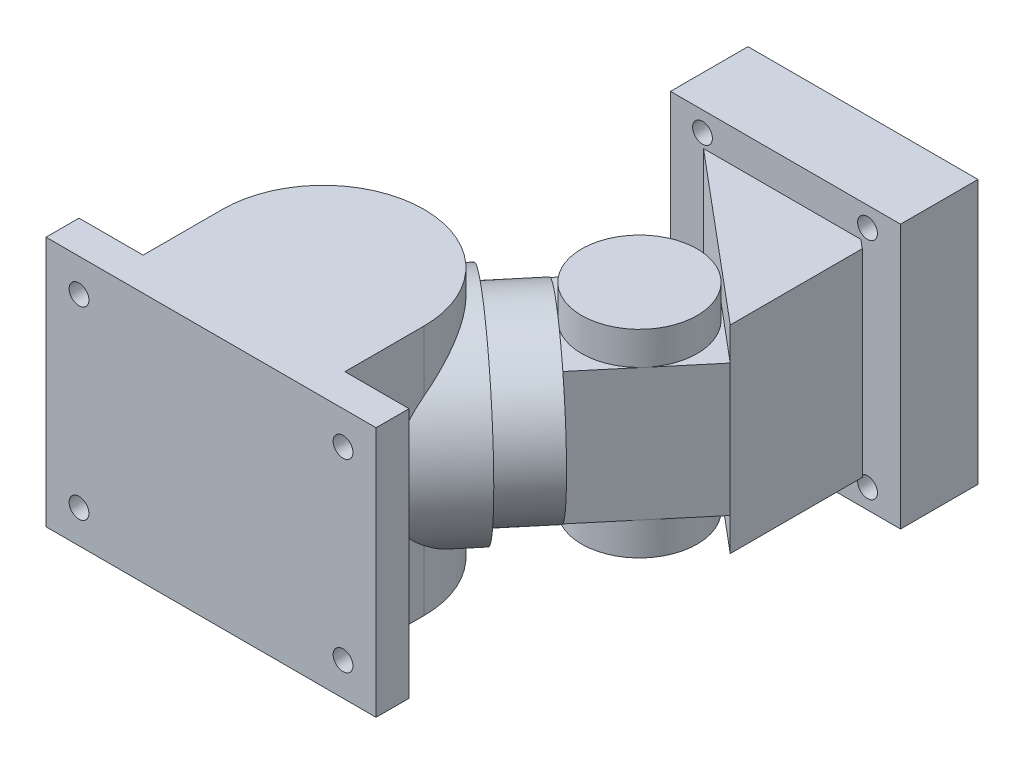
from build123d import *
from build123d.topology import SkipClean

# Parameters (mm, degrees)
SALIENTE_EXTRUIR1_DEPTH       = 15
SALIENTE_EXTRUIR1_DEPTH_BACK  = 15
SALIENTE_EXTRUIR3_DEPTH       = 10
SALIENTE_EXTRUIR3_DEPTH_BACK  = 10
SALIENTE_EXTRUIR9_DEPTH       = 5
SALIENTE_EXTRUIR9_DEPTH_BACK  = 25
CROQUIS4_R                    = 8.75
SALIENTE_EXTRUIR10_DEPTH      = 10
SALIENTE_EXTRUIR10_DEPTH_BACK = 10
CROQUIS6_R                    = 13.287682266
SALIENTE_EXTRUIR11_DEPTH      = 8
CROQUIS7_R                    = 15.287682266
SALIENTE_EXTRUIR12_DEPTH      = 17
SALIENTE_EXTRUIR13_DEPTH      = 17
SALIENTE_EXTRUIR13_DEPTH_BACK = 17
CROQUIS9_R                    = 15.287682266
SALIENTE_EXTRUIR14_DEPTH      = 2
SALIENTE_EXTRUIR14_DEPTH_BACK = 36
SALIENTE_EXTRUIR15_DEPTH      = 5
SALIENTE_EXTRUIR15_DEPTH_BACK = 35
CROQUIS11_W                   = 34.848077531
CROQUIS11_H                   = 11.736481777
CROQUIS12_R                   = 1.5
CORTAR_EXTRUIR1_DEPTH         = 35000
CROQUIS13_R                   = 1.5
CORTAR_EXTRUIR2_DEPTH         = 35000


with BuildPart() as part:
    # Croquis1 → Saliente-Extruir1 (new, two sides: drawn at the far end of the back side and taken through both)
    with BuildSketch(Plane(origin=(0, 0, 0), x_dir=(1, 0, 0), z_dir=(0, 1, 0)).offset(-SALIENTE_EXTRUIR1_DEPTH_BACK)):
        Polygon((0, 0), (0, 20), (-15.320888862, 32.855752194), (-25.168966393, 21.119270417), align=None)
    extrude(amount=SALIENTE_EXTRUIR1_DEPTH + SALIENTE_EXTRUIR1_DEPTH_BACK)

    # Croquis2 → Saliente-Extruir3 (add, two sides: drawn at the far end of the back side and taken through both)
    with BuildSketch(Plane(origin=(0, 0, 0), x_dir=(1, 0, 0), z_dir=(0, 1, 0)).offset(-SALIENTE_EXTRUIR3_DEPTH_BACK)):
        with BuildLine():
            Line((0, 0), (-13.405777755, 11.24878317))
            Line((-13.405777755, 11.24878317), (-19.190866242, 4.354383181))
            ThreePointArc((-19.190866242, 4.354383181), (-18.112368949, -7.972897281), (-5.785088487, -6.894399988))
            Line((-5.785088487, -6.894399988), (0, 0))
        make_face()
    extrude(amount=SALIENTE_EXTRUIR3_DEPTH + SALIENTE_EXTRUIR3_DEPTH_BACK)

    # Croquis4 → Saliente-Extruir9 (add, two sides: drawn at the far end of the back side and taken through both)
    with SkipClean():  # the faces are left unmerged after this step: merging them gives an invalid solid
        with BuildSketch(Plane(origin=(0, 10, 0), x_dir=(1, 0, 0), z_dir=(0, 1, 0)).offset(-SALIENTE_EXTRUIR9_DEPTH_BACK)):
            with Locations((-12.487977364, -1.270008403)):
                Circle(CROQUIS4_R)
        extrude(amount=SALIENTE_EXTRUIR9_DEPTH + SALIENTE_EXTRUIR9_DEPTH_BACK)

    # Croquis5 → Saliente-Extruir10 (add, two sides: drawn at the far end of the back side and taken through both)
    with BuildSketch(Plane(origin=(0, 0, 0), x_dir=(1, 0, 0), z_dir=(0, 1, 0)).offset(-SALIENTE_EXTRUIR10_DEPTH_BACK)):
        with BuildLine():
            Line((-11.570176974, -13.788799976), (-5.785088487, -6.894399988))
            ThreePointArc((-5.785088487, -6.894399988), (-6.86358578, 5.432880474), (-19.190866242, 4.354383181))
            Line((-19.190866242, 4.354383181), (-24.975954729, -2.540016807))
            Line((-24.975954729, -2.540016807), (-11.570176974, -13.788799976))
        make_face()
    extrude(amount=SALIENTE_EXTRUIR10_DEPTH + SALIENTE_EXTRUIR10_DEPTH_BACK)

    # Croquis6 → Saliente-Extruir11 (add)
    with BuildSketch(Plane(origin=(-11.570176974, 0, 13.788799976), x_dir=(0.7660444431189747, 0, 0.6427876096865435), z_dir=(-0.6427876096865434, 0, 0.7660444431189746))):
        with Locations((-8.75, 0)):
            Circle(CROQUIS6_R)
    extrude(amount=SALIENTE_EXTRUIR11_DEPTH)

    # Croquis7 → Saliente-Extruir12 (add)
    with BuildSketch(Plane(origin=(-16.712477852, 0, 19.917155521), x_dir=(0.7660444431189747, 0, 0.6427876096865435), z_dir=(-0.6427876096865434, 0, 0.7660444431189746))):
        with Locations((-8.75, 0)):
            Circle(CROQUIS7_R)
    extrude(amount=SALIENTE_EXTRUIR12_DEPTH)

    # Croquis9 → Saliente-Extruir13 (add, two sides: drawn at the far end of the back side and taken through both)
    with BuildSketch(Plane(origin=(0, 0, 0), x_dir=(1, 0, 0), z_dir=(0, 1, 0)).offset(-SALIENTE_EXTRUIR13_DEPTH_BACK)):
        with Locations((-34.342756094, -27.315519469)):
            Circle(CROQUIS9_R)
    extrude(amount=SALIENTE_EXTRUIR13_DEPTH + SALIENTE_EXTRUIR13_DEPTH_BACK)

    # Croquis10 → Saliente-Extruir14 (add, two sides: drawn at the far end of the back side and taken through both)
    with BuildSketch(Plane(origin=(0, 17, 0), x_dir=(1, 0, 0), z_dir=(0, 1, 0)).offset(-SALIENTE_EXTRUIR14_DEPTH_BACK)):
        with BuildLine():
            Line((-49.63043836, -27.315519469), (-49.63043836, -39.315519469))
            Line((-49.63043836, -39.315519469), (-59.342756094, -39.315519469))
            Line((-59.342756094, -39.315519469), (-59.342756094, -44.315519469))
            Line((-59.342756094, -44.315519469), (-9.342756094, -44.315519469))
            Line((-9.342756094, -44.315519469), (-9.342756094, -39.315519469))
            Line((-9.342756094, -39.315519469), (-19.055073828, -39.315519469))
            Line((-19.055073828, -39.315519469), (-19.055073828, -27.315519469))
            ThreePointArc((-19.055073828, -27.315519469), (-34.342756094, -12.027837203), (-49.63043836, -27.315519469))
        make_face()
    extrude(amount=SALIENTE_EXTRUIR14_DEPTH + SALIENTE_EXTRUIR14_DEPTH_BACK)

    # Croquis11 → Saliente-Extruir15 (add, two sides: drawn at the far end of the back side and taken through both)
    with BuildSketch(Plane(origin=(0, 15, 0), x_dir=(1, 0, 0), z_dir=(0, 1, 0)).offset(-SALIENTE_EXTRUIR15_DEPTH_BACK)):
        with Locations((-12.744927628, 26.987511306)):
            Rectangle(CROQUIS11_W, CROQUIS11_H)
    extrude(amount=SALIENTE_EXTRUIR15_DEPTH + SALIENTE_EXTRUIR15_DEPTH_BACK)

    # Croquis12 → Cortar-Extruir1 (cut)
    with BuildSketch(Plane.XY.offset(-21.119270417)):
        with Locations((-0.320888862, 17)):
            Circle(CROQUIS12_R)
        with Locations((-25.320888862, 17)):
            Circle(CROQUIS12_R)
        with Locations((-25.320888862, -17)):
            Circle(CROQUIS12_R)
        with Locations((-0.320888862, -17)):
            Circle(CROQUIS12_R)
    extrude(amount=-CORTAR_EXTRUIR1_DEPTH, mode=Mode.SUBTRACT)

    # Croquis13 → Cortar-Extruir2 (cut)
    with BuildSketch(Plane(origin=(0, 0, 39.315519469), x_dir=(-1, 0, 0), z_dir=(0, 0, -1))):
        with Locations((54.342756094, 14)):
            Circle(CROQUIS13_R)
        with Locations((54.342756094, -14)):
            Circle(CROQUIS13_R)
        with Locations((14.342756094, 14)):
            Circle(CROQUIS13_R)
        with Locations((14.342756094, -14)):
            Circle(CROQUIS13_R)
    extrude(amount=-CORTAR_EXTRUIR2_DEPTH, mode=Mode.SUBTRACT)


solid = part.part
